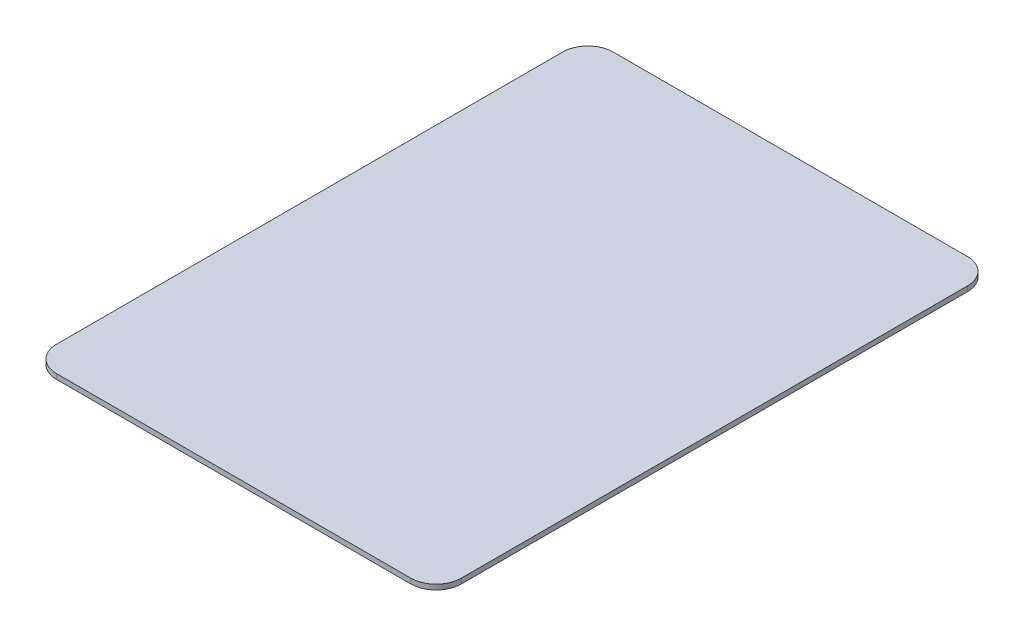
from build123d import *

# Parameters (mm, degrees)
SKETCH1_W           = 508
SKETCH1_H           = 698.5
BOSS_EXTRUDE1_DEPTH = 6.35
FILLET1_R           = 31.75


with BuildPart() as part:
    # Sketch1 → Boss-Extrude1 (new body)
    with BuildSketch(Plane(origin=(0, 0, 0), x_dir=(1, 0, 0), z_dir=(0, 1, 0))):
        Rectangle(SKETCH1_W, SKETCH1_H)
    extrude(amount=BOSS_EXTRUDE1_DEPTH)

    # Fillet1
    fillet1_edges = [part.edges().sort_by_distance(p)[0] for p in [
        (254, 3.175, 349.25),
        (-254, 3.175, 349.25),
        (-254, 3.175, -349.25),
        (254, 3.175, -349.25),
    ]]
    fillet(fillet1_edges, radius=FILLET1_R)


solid = part.part
